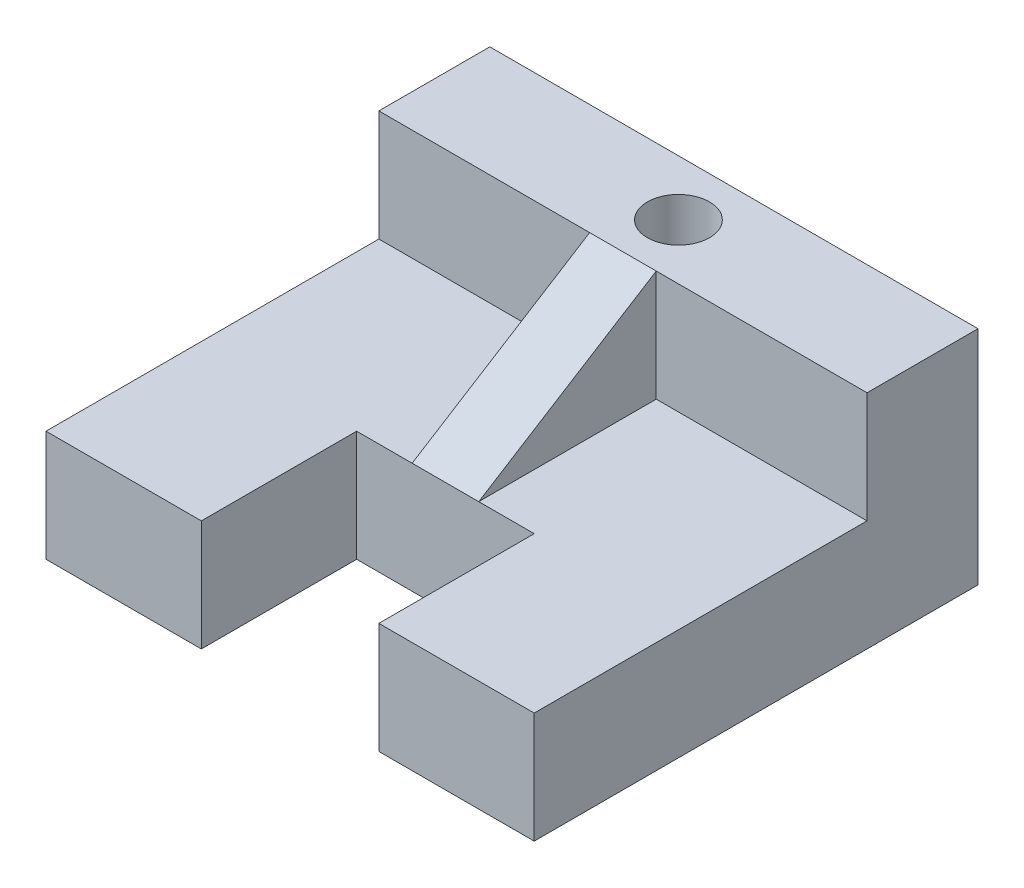
from build123d import *

# Parameters (mm, degrees)
SKETCH_1_W          = 110
SKETCH_1_H          = 100
EXTRUDE_1_DEPTH     = 25
SKETCH_2_W          = 110
SKETCH_2_H          = 25
EXTRUDE_2_DEPTH     = 25
SKETCH_3_W          = 40
SKETCH_3_H          = 35
CUT_EXTRUDE_1_DEPTH = 79.421935707
RIB_1_REACH         = 91.582
SKETCH_4_WALL_W     = 228.334634332
SKETCH_4_WALL_H     = 15
SKETCH_5_R          = 7
CUT_EXTRUDE_2_DEPTH = 90.582364336


with BuildPart() as part:
    # Эскиз1 → Бобышка-Вытянуть1 (new body)
    with BuildSketch(Plane(origin=(0, 0, 0), x_dir=(1, 0, 0), z_dir=(0, 1, 0))):
        Rectangle(SKETCH_1_W, SKETCH_1_H)
    extrude(amount=EXTRUDE_1_DEPTH)

    # Эскиз2 → Бобышка-Вытянуть2 (add)
    with BuildSketch(Plane(origin=(0, 25, 0), x_dir=(1, 0, 0), z_dir=(0, 1, 0))):
        with Locations((0, 37.5)):
            Rectangle(SKETCH_2_W, SKETCH_2_H)
    extrude(amount=EXTRUDE_2_DEPTH)

    # Эскиз3 → Вырез-Вытянуть1 (cut, through all)
    with BuildSketch(Plane(origin=(0, 25, 0), x_dir=(1, 0, 0), z_dir=(0, 1, 0))):
        with Locations((0, -32.5)):
            Rectangle(SKETCH_3_W, SKETCH_3_H)
    extrude(amount=-CUT_EXTRUDE_1_DEPTH, mode=Mode.SUBTRACT)

    # Эскиз4 wall → Ребро1 (add, up to next)
    with BuildSketch(Plane(origin=(0, 37.5, -5), x_dir=(0, -0.529998940003, 0.847998304005), z_dir=(0, -0.847998304005, -0.529998940003)), mode=Mode.PRIVATE) as rib_1_sk1:
        Rectangle(SKETCH_4_WALL_W, SKETCH_4_WALL_H)
    rib_1_tool1 = extrude(rib_1_sk1.sketch, amount=RIB_1_REACH, mode=Mode.PRIVATE) - part.part
    add(rib_1_tool1.solids().sort_by_distance((0, 37.5, -5))[0])

    # Эскиз5 → Вырез-Вытянуть2 (cut, through all)
    with BuildSketch(Plane(origin=(0, 50, 0), x_dir=(1, 0, 0), z_dir=(0, 1, 0))):
        with Locations(Location((0, 37.5, 0), (0, 0, 270))):
            Circle(SKETCH_5_R)
    extrude(amount=-CUT_EXTRUDE_2_DEPTH, mode=Mode.SUBTRACT)


solid = part.part
